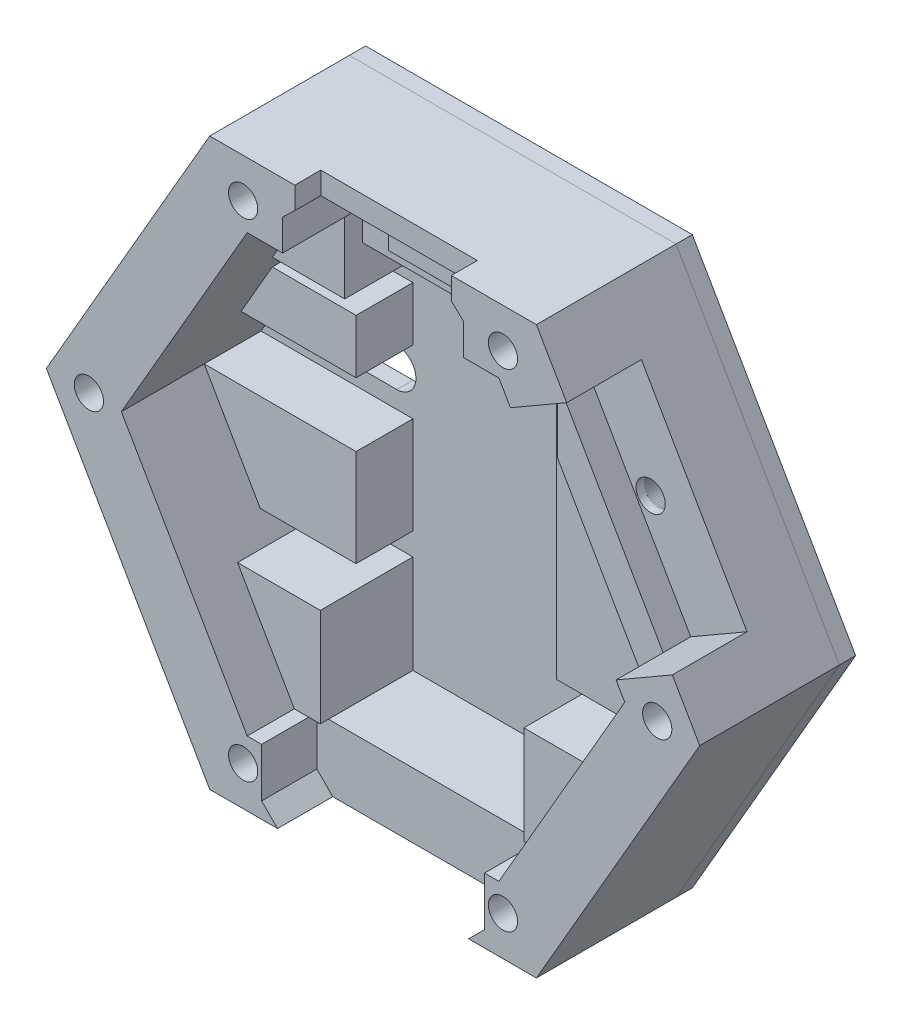
from build123d import *

# Parameters (mm, degrees)
EXTRUDE_1_DEPTH     = 7
CUT_EXTRUDE_1_DEPTH = 1.8
CUT_EXTRUDE_2_DEPTH = 3
EXTRUDE_4_DEPTH     = 5.7
EXTRUDE_4_2_DEPTH   = 5.7
EXTRUDE_4_3_DEPTH   = 5.7
EXTRUDE_4_4_DEPTH   = 5.7
EXTRUDE_21_DEPTH    = 3.5
EXTRUDE_21_2_DEPTH  = 3.5
EXTRUDE_21_3_DEPTH  = 3.5
EXTRUDE_21_4_DEPTH  = 3.5
EXTRUDE_22_DEPTH    = 1
CUT_EXTRUDE_3_DEPTH = 10
CUT_EXTRUDE_4_DEPTH = 1.5
CUT_EXTRUDE_5_DEPTH = 1
EXTRUDE_23_DEPTH    = 1.6
SKETCH_17_R         = 0.9
CUT_EXTRUDE_6_DEPTH = 20
SKETCH_19_R         = 1.75
CUT_EXTRUDE_7_DEPTH = 2
SKETCH_20_R         = 0.9
CUT_EXTRUDE_8_DEPTH = 6


with BuildPart() as part:
    # 草图1 → 凸台-拉伸1 (new body)
    with BuildSketch(Plane.XY):
        Polygon((10.059401077, 17.423393759), (-10.059401077, 17.423393759), (-20.118802154, 0), (-10.059401077, -17.423393759), (10.059401077, -17.423393759), (20.118802154, 0), align=None)
        Polygon((15.5, 0), (7.75, 13.423393759), (-7.75, 13.423393759), (-15.5, 0), (-7.75, -13.423393759), (7.75, -13.423393759), align=None, mode=Mode.SUBTRACT)
    extrude(amount=EXTRUDE_1_DEPTH)

    # 草图2 → 切除-拉伸1 (cut)
    with BuildSketch(Plane.XY.offset(7)):
        Polygon((6.863269886, -16.440794429), (6.863269886, -13.423393759), (-6.863269886, -13.423393759), (-6.863269886, -16.440794429), (-5.880670556, -17.423393759), (5.880670556, -17.423393759), align=None)
        Polygon((-4.820110193, 16.061828693), (4.820110193, 16.061828693), (5.573466666, 15.349903558), (5.573466666, 13.423393759), (-5.573466666, 13.423393759), (-5.573466666, 15.349903558), align=None)
    extrude(amount=-CUT_EXTRUDE_1_DEPTH, mode=Mode.SUBTRACT)

    # 草图3 → 切除-拉伸2 (cut)
    with BuildSketch(Plane.XY.offset(7)):
        Polygon((8.460606166, 12.192587775), (11.924707781, 14.192587775), (18.428840745, 2.927099023), (14.96473913, 0.927099023), align=None)
    extrude(amount=-CUT_EXTRUDE_2_DEPTH, mode=Mode.SUBTRACT)

    # 草图15 → 切除-拉伸5 (cut)
    with BuildSketch(Plane.XY.offset(5.2)):
        Polygon((-2.444629032, 16.061828693), (-2.444629032, 13.423393759), (-5.573466666, 13.423393759), (-5.573466666, 15.349903558), (-4.820110193, 16.061828693), align=None)
        Polygon((4.820110193, 16.061828693), (2.444629032, 16.061828693), (2.444629032, 13.423393759), (5.573466666, 13.423393759), (5.573466666, 15.349903558), align=None)
    extrude(amount=-CUT_EXTRUDE_5_DEPTH, mode=Mode.SUBTRACT)

    # 草图18 → 凸台-拉伸23 (add)
    with BuildSketch(Plane.XY.offset(7)):
        Polygon((-4.820110193, 16.061828693), (-4.820110193, 17.423393759), (-10.059401077, 17.423393759), (-20.118802154, 0), (-10.059401077, -17.423393759), (-5.880670556, -17.423393759), (-6.863269886, -16.440794429), (-6.863269886, -13.423393759), (-7.75, -13.423393759), (-15.5, 0), (-7.75, 13.423393759), (-5.573466666, 13.423393759), (-5.573466666, 15.349903558), align=None)
        Polygon((4.820110193, 16.061828693), (4.820110193, 17.423393759), (10.059401077, 17.423393759), (11.924707781, 14.192587775), (8.460606166, 12.192587775), (7.75, 13.423393759), (5.573466666, 13.423393759), (5.573466666, 15.349903558), align=None)
        Polygon((18.428840745, 2.927099023), (14.96473913, 0.927099023), (15.5, 0), (7.75, -13.423393759), (6.863269886, -13.423393759), (6.863269886, -16.440794429), (5.880670556, -17.423393759), (10.059401077, -17.423393759), (20.118802154, 0), align=None)
    extrude(amount=EXTRUDE_23_DEPTH)


with BuildPart() as body_2:
    # 草图4 → 凸台-拉伸4 (new body)
    with BuildSketch(Plane(origin=(0, 0, 0), x_dir=(-1, 0, 0), z_dir=(0, 0, -1))):
        Polygon((-11.245593136, -7.368848845), (-6.382277748, -7.368848845), (-6.382277748, -13.423393759), (-7.75, -13.423393759), align=None)
    extrude(amount=-EXTRUDE_4_DEPTH)


with BuildPart() as body_3:
    # 草图4 → Extrude 4 2 (new body)
    with BuildSketch(Plane(origin=(0, 0, 0), x_dir=(-1, 0, 0), z_dir=(0, 0, -1))):
        Polygon((6.145280676, -7.368848845), (11.245593136, -7.368848845), (7.75, -13.423393759), (6.145280676, -13.423393759), align=None)
    extrude(amount=-EXTRUDE_4_2_DEPTH)


with BuildPart() as body_4:
    # 草图4 → Extrude 4 3 (new body)
    with BuildSketch(Plane(origin=(0, 0, 0), x_dir=(-1, 0, 0), z_dir=(0, 0, -1))):
        Polygon((6.145280676, 13.423393759), (6.145280676, 8.488540604), (10.599138797, 8.488540604), (7.75, 13.423393759), align=None)
    extrude(amount=-EXTRUDE_4_3_DEPTH)


with BuildPart() as body_5:
    # 草图4 → Extrude 4 4 (new body)
    with BuildSketch(Plane(origin=(0, 0, 0), x_dir=(-1, 0, 0), z_dir=(0, 0, -1))):
        Polygon((-8.460606166, 12.192587775), (-6.674189613, 11.161199697), (-13.502811472, -0.666320308), (-15.289228025, 0.365067769), align=None)
    extrude(amount=-EXTRUDE_4_4_DEPTH)


with BuildPart() as body_6:
    # 草图6 → 凸台-拉伸21 (new body)
    with BuildSketch(Plane(origin=(0, 0, 0), x_dir=(-1, 0, 0), z_dir=(0, 0, -1))):
        Polygon((-7.167145457, 10.307375129), (-6.189945384, 10.307375129), (-6.189945384, -5.980150499), (-12.0473585, -5.980150499), (-13.626264811, -5.980150499), (-17.36358489, 0), (-11.472554935, 10.307375129), (-9.549034195, 10.307375129), align=None)
    extrude(amount=-EXTRUDE_21_DEPTH)


with BuildPart() as body_7:
    # 草图6 → Extrude 21 2 (new body)
    with BuildSketch(Plane(origin=(0, 0, 0), x_dir=(-1, 0, 0), z_dir=(0, 0, -1))):
        Polygon((-5.839026937, 13.423393759), (-5.839026937, 11.342651293), (5.746496449, 11.342651293), (5.746496449, 13.423393759), (5.746496449, 15.340981073), (-5.839026937, 15.340981073), align=None)
    extrude(amount=-EXTRUDE_21_2_DEPTH)


with BuildPart() as body_8:
    # 草图6 → Extrude 21 3 (new body)
    with BuildSketch(Plane(origin=(0, 0, 0), x_dir=(-1, 0, 0), z_dir=(0, 0, -1))):
        Polygon((6.145280676, 7.264816527), (6.145280676, 3.935780446), (14.892625012, 3.935780446), (12.812129983, 7.264816527), align=None)
    extrude(amount=-EXTRUDE_21_3_DEPTH)


with BuildPart() as body_9:
    # 草图6 → Extrude 21 4 (new body)
    with BuildSketch(Plane(origin=(0, 0, 0), x_dir=(-1, 0, 0), z_dir=(0, 0, -1))):
        Polygon((6.145280676, -5.980150499), (12.0473585, -5.980150499), (13.934439655, -5.980150499), (17.352307472, 0), (6.145280676, 0), align=None)
    extrude(amount=-EXTRUDE_21_4_DEPTH)


with BuildPart() as body_10:
    # 草图12 → 凸台-拉伸22 (new body)
    with BuildSketch(Plane(origin=(0, 0, 0), x_dir=(-1, 0, 0), z_dir=(0, 0, -1))):
        Polygon((-10.059401077, 17.423393759), (-20.118802154, 0), (-10.059401077, -17.423393759), (10.059401077, -17.423393759), (20.118802154, 0), (10.059401077, 17.423393759), align=None)
    extrude(amount=EXTRUDE_22_DEPTH)

    # 草图13 → 切除-拉伸3 (cut)
    with BuildSketch(Plane(origin=(0, 0, -1), x_dir=(-1, 0, 0), z_dir=(0, 0, -1))):
        with BuildLine():
            Line((10.123406841, 1.062471913), (7.135900995, 1.062471913))
            ThreePointArc((7.135900995, 1.062471913), (5.95884516, 2.239527747), (7.135900995, 3.416583581))
            Line((7.135900995, 3.416583581), (10.123406841, 3.416583581))
            ThreePointArc((10.123406841, 3.416583581), (11.300462675, 2.239527747), (10.123406841, 1.062471913))
        make_face()
    extrude(amount=-CUT_EXTRUDE_3_DEPTH, mode=Mode.SUBTRACT)


with BuildPart() as cut_extrude_4_tool:
    # 草图14 → 切除-拉伸4 (new body)
    with BuildSketch(Plane.XY.offset(5.7)):
        Polygon((-7.75, 13.423393759), (-6.145280676, 13.423393759), (-6.145280676, 8.463494867), (-10.599138797, 8.488540604), align=None)
        Polygon((8.460347777, 12.192438594), (8.460347777, 8.067483007), (6.674189613, 11.161199697), align=None)
    extrude(amount=-CUT_EXTRUDE_4_DEPTH)


with BuildPart() as body_4_1:
    add(body_4.part)

    # 切除-拉伸4: cut by cut_extrude_4_tool
    add(cut_extrude_4_tool.part, mode=Mode.SUBTRACT)


with BuildPart() as body_5_1:
    add(body_5.part)

    # 切除-拉伸4: cut by cut_extrude_4_tool
    add(cut_extrude_4_tool.part, mode=Mode.SUBTRACT)


with BuildPart() as cut_extrude_6_tool:
    # 草图17 → 切除-拉伸6 (new body)
    with BuildSketch(Plane(origin=(0, 0, -1), x_dir=(-1, 0, 0), z_dir=(0, 0, -1))):
        with Locations((8, 15)):
            Circle(SKETCH_17_R)
        with Locations((8, -15)):
            Circle(SKETCH_17_R)
        with Locations((-8, -15)):
            Circle(SKETCH_17_R)
        with Locations((-8, 15)):
            Circle(SKETCH_17_R)
        with Locations((17.5, 0)):
            Circle(SKETCH_17_R)
        with Locations((-17.5, 0)):
            Circle(SKETCH_17_R)
    extrude(amount=-CUT_EXTRUDE_6_DEPTH)


with BuildPart() as part_1:
    add(part.part)

    # 切除-拉伸6: cut by cut_extrude_6_tool
    add(cut_extrude_6_tool.part, mode=Mode.SUBTRACT)


with BuildPart() as body_6_1:
    add(body_6.part)

    # 切除-拉伸6: cut by cut_extrude_6_tool
    add(cut_extrude_6_tool.part, mode=Mode.SUBTRACT)


with BuildPart() as body_9_1:
    add(body_9.part)

    # 切除-拉伸6: cut by cut_extrude_6_tool
    add(cut_extrude_6_tool.part, mode=Mode.SUBTRACT)


with BuildPart() as body_10_1:
    add(body_10.part)

    # 切除-拉伸6: cut by cut_extrude_6_tool
    add(cut_extrude_6_tool.part, mode=Mode.SUBTRACT)


with BuildPart() as cut_extrude_7_tool:
    # 草图19 → 切除-拉伸7 (new body)
    with BuildSketch(Plane(origin=(0, 0, -1), x_dir=(-1, 0, 0), z_dir=(0, 0, -1))):
        with Locations((-8, 15)):
            Circle(SKETCH_19_R)
        with Locations((-17.5, 0)):
            Circle(SKETCH_19_R)
        with Locations((-8, -15)):
            Circle(SKETCH_19_R)
        with Locations((8, -15)):
            Circle(SKETCH_19_R)
        with Locations((17.5, 0)):
            Circle(SKETCH_19_R)
        with Locations((8, 15)):
            Circle(SKETCH_19_R)
    extrude(amount=-CUT_EXTRUDE_7_DEPTH)


with BuildPart() as part_2:
    add(part_1.part)

    # 切除-拉伸7: cut by cut_extrude_7_tool
    add(cut_extrude_7_tool.part, mode=Mode.SUBTRACT)


with BuildPart() as body_2_1:
    add(body_2.part)

    # 切除-拉伸7: cut by cut_extrude_7_tool
    add(cut_extrude_7_tool.part, mode=Mode.SUBTRACT)


with BuildPart() as body_3_1:
    add(body_3.part)

    # 切除-拉伸7: cut by cut_extrude_7_tool
    add(cut_extrude_7_tool.part, mode=Mode.SUBTRACT)


with BuildPart() as body_4_2:
    add(body_4_1.part)

    # 切除-拉伸7: cut by cut_extrude_7_tool
    add(cut_extrude_7_tool.part, mode=Mode.SUBTRACT)


with BuildPart() as body_6_2:
    add(body_6_1.part)

    # 切除-拉伸7: cut by cut_extrude_7_tool
    add(cut_extrude_7_tool.part, mode=Mode.SUBTRACT)


with BuildPart() as body_9_2:
    add(body_9_1.part)

    # 切除-拉伸7: cut by cut_extrude_7_tool
    add(cut_extrude_7_tool.part, mode=Mode.SUBTRACT)


with BuildPart() as body_10_2:
    add(body_10_1.part)

    # 切除-拉伸7: cut by cut_extrude_7_tool
    add(cut_extrude_7_tool.part, mode=Mode.SUBTRACT)


with BuildPart() as cut_extrude_8_tool:
    # 草图20 → 切除-拉伸8 (new body)
    with BuildSketch(Plane(origin=(0, 0, -1), x_dir=(-1, 0, 0), z_dir=(0, 0, -1))):
        with Locations((0, 15)):
            Circle(SKETCH_20_R)
        with Locations((-12.495190528, 7.214101615)):
            Circle(SKETCH_20_R)
        with Locations((12.495190528, 7.214101615)):
            Circle(SKETCH_20_R)
        with Locations((-12.495190528, -7.214101615)):
            Circle(SKETCH_20_R)
        with Locations((12.495190528, -7.214101615)):
            Circle(SKETCH_20_R)
        with Locations((0, -15)):
            Circle(SKETCH_20_R)
    extrude(amount=-CUT_EXTRUDE_8_DEPTH)


with BuildPart() as part_3:
    add(part_2.part)

    # 切除-拉伸8: cut by cut_extrude_8_tool
    add(cut_extrude_8_tool.part, mode=Mode.SUBTRACT)


with BuildPart() as body_6_3:
    add(body_6_2.part)

    # 切除-拉伸8: cut by cut_extrude_8_tool
    add(cut_extrude_8_tool.part, mode=Mode.SUBTRACT)


with BuildPart() as body_7_1:
    add(body_7.part)

    # 切除-拉伸8: cut by cut_extrude_8_tool
    add(cut_extrude_8_tool.part, mode=Mode.SUBTRACT)


with BuildPart() as body_8_1:
    add(body_8.part)

    # 切除-拉伸8: cut by cut_extrude_8_tool
    add(cut_extrude_8_tool.part, mode=Mode.SUBTRACT)


with BuildPart() as body_10_3:
    add(body_10_2.part)

    # 切除-拉伸8: cut by cut_extrude_8_tool
    add(cut_extrude_8_tool.part, mode=Mode.SUBTRACT)


solid = Compound([body_5_1.part, body_2_1.part, body_3_1.part, body_4_2.part, body_9_2.part, part_3.part, body_6_3.part, body_7_1.part, body_8_1.part, body_10_3.part])
